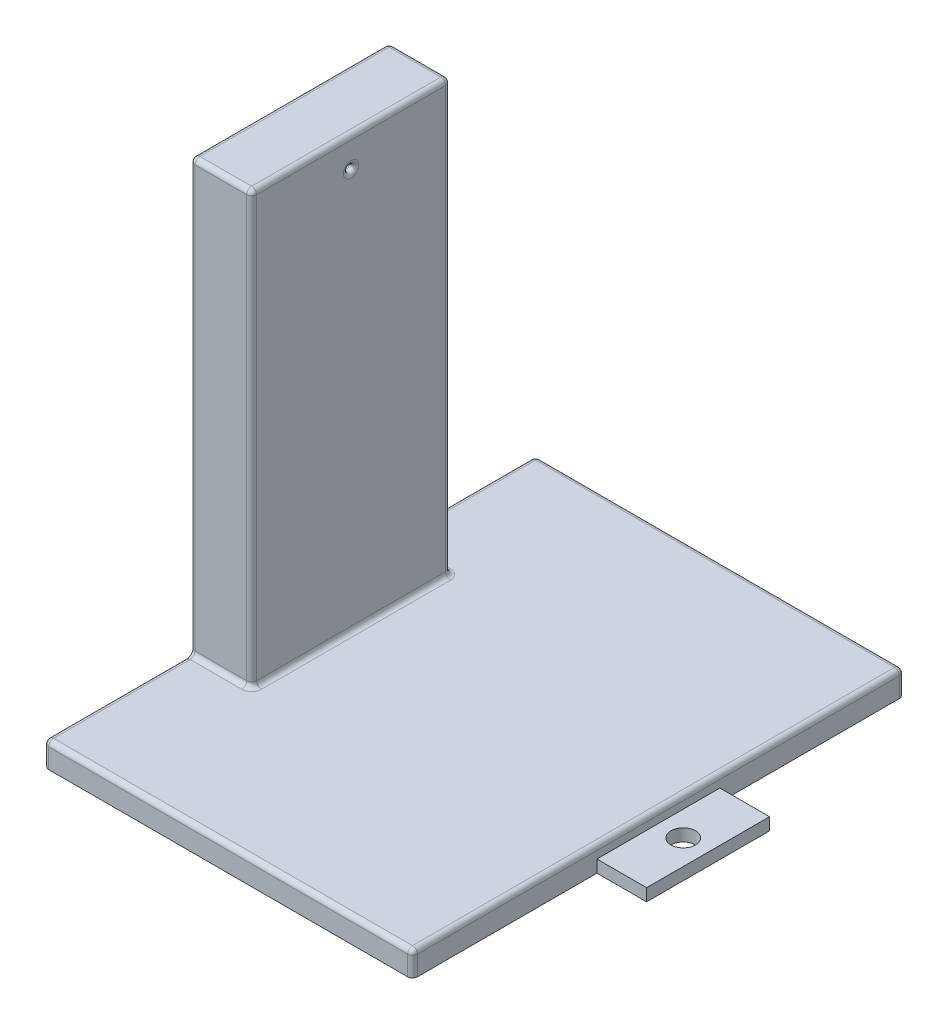
from build123d import *

# Parameters (mm, degrees)
ESQUISSE2_W                  = 150
ESQUISSE2_H                  = 200
BOSS_EXTRU_2_DEPTH           = 10
ESQUISSE3_W                  = 25
ESQUISSE3_H                  = 80.898254602
BOSS_EXTRU_3_DEPTH           = 165
ESQUISSE7_W                  = 50
ESQUISSE7_H                  = 5
BOSS_EXTRU_4_DEPTH           = 95.2
ENL_V_MAT_EXTRU_2_DEPTH      = 95.2
ENL_V_MAT_EXTRU_2_DEPTH_BACK = 95.2
ESQUISSE8_R                  = 5
ESQUISSE9_W                  = 25
ESQUISSE9_H                  = 80.898254602
BOSS_EXTRU_5_DEPTH           = 185.2
ESQUISSE10_R                 = 1.125
ENL_V_MAT_EXTRU_3_DEPTH      = 185.2
CONG_1_R                     = 2


with BuildPart() as part:
    # Esquisse2 → Boss.-Extru.2 (new body)
    with BuildSketch(Plane(origin=(0, 0, 0), x_dir=(1, 0, 0), z_dir=(0, 1, 0))):
        Rectangle(ESQUISSE2_W, ESQUISSE2_H)
    extrude(amount=BOSS_EXTRU_2_DEPTH)

    # Esquisse3 → Boss.-Extru.3 (add)
    with BuildSketch(Plane(origin=(0, 0, 0), x_dir=(1, 0, 0), z_dir=(0, 1, 0))):
        with Locations((-62.5, 0)):
            Rectangle(ESQUISSE3_W, ESQUISSE3_H)
    extrude(amount=BOSS_EXTRU_3_DEPTH)

    # Esquisse7 → Boss.-Extru.4 (add)
    with BuildSketch(Plane(origin=(0, 0, 0), x_dir=(0, 0, -1), z_dir=(1, 0, 0))):
        with Locations((0, 2.5)):
            Rectangle(ESQUISSE7_W, ESQUISSE7_H)
    extrude(amount=BOSS_EXTRU_4_DEPTH)

    # Esquisse8 → Enlèv. mat.-Extru.2 (cut, two sides: drawn at the far end of the back side and taken through both)
    with BuildSketch(Plane(origin=(0, 0, 0), x_dir=(1, 0, 0), z_dir=(0, 1, 0)).offset(-ENL_V_MAT_EXTRU_2_DEPTH_BACK)):
        with Locations(Location((85.1, 0, 0), (0, 0, 90))):
            Circle(ESQUISSE8_R)
    extrude(amount=ENL_V_MAT_EXTRU_2_DEPTH + ENL_V_MAT_EXTRU_2_DEPTH_BACK, mode=Mode.SUBTRACT)

    # Esquisse9 → Boss.-Extru.5 (add)
    with BuildSketch(Plane(origin=(0, 0, 0), x_dir=(1, 0, 0), z_dir=(0, 1, 0))):
        with Locations((-62.5, 0)):
            Rectangle(ESQUISSE9_W, ESQUISSE9_H)
    extrude(amount=BOSS_EXTRU_5_DEPTH)

    # Esquisse10 → Enlèv. mat.-Extru.3 (cut)
    with BuildSketch(Plane(origin=(0, 0, 0), x_dir=(0, 0, -1), z_dir=(1, 0, 0))):
        with Locations((0, 172.95)):
            Circle(ESQUISSE10_R)
    extrude(amount=-ENL_V_MAT_EXTRU_3_DEPTH, mode=Mode.SUBTRACT)

    # Congé1
    cong_1_edges = [part.edges().sort_by_distance(p)[0] for p in [
        (75, 10, 0),
        (-75, 10, 70.224563651),
        (0, 10, -100),
        (-62.5, 10, -40.449127301),
        (-62.5, 10, 40.449127301),
        (-50, 10, 0),
        (-50, 97.6, -40.449127301),
        (-75, 97.6, -40.449127301),
        (-75, 97.6, 40.449127301),
        (-50, 97.6, 40.449127301),
        (-75, 10, -70.224563651),
        (-75, 0, 0),
        (-50, 185.2, 0),
        (-62.5, 185.2, -40.449127301),
        (-75, 185.2, 0),
        (-62.5, 185.2, 40.449127301),
        (-75, 5, -100),
        (75, 5, -100),
        (75, 5, 100),
        (-75, 5, 100),
        (-50, 172.95, 1.125),
        (-75, 172.95, 1.125),
        (0, 10, 100),
    ]]
    fillet(cong_1_edges, radius=CONG_1_R)


solid = part.part
